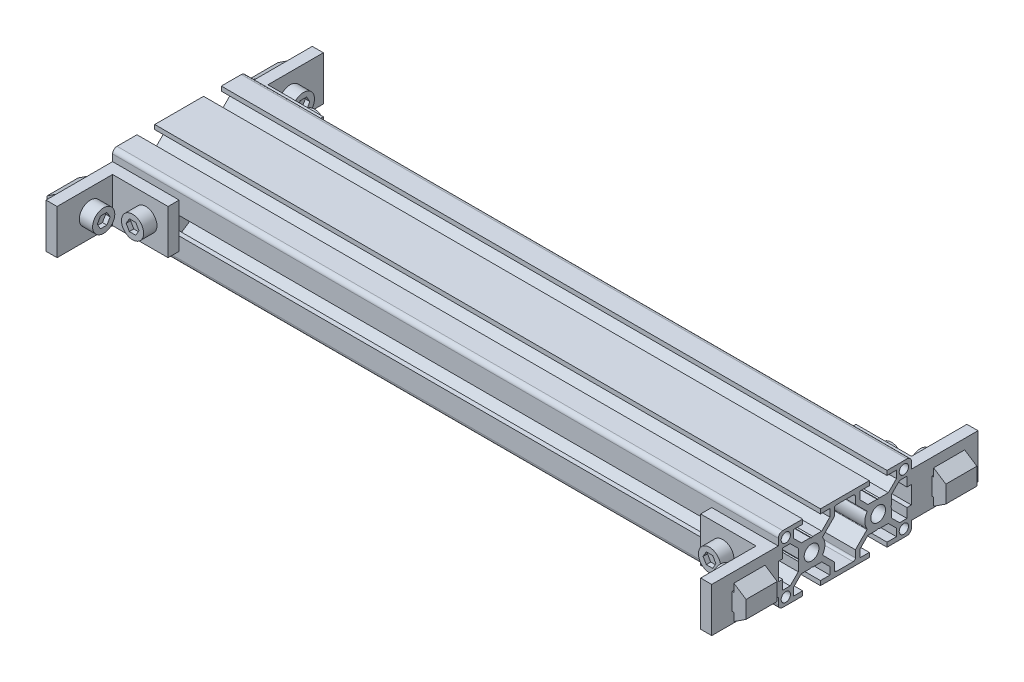
from build123d import *

# Parameters (mm, degrees)
SKETCH1_R            = 2.1
SKETCH1_R_2          = 3.3235
BOSS_EXTRUDE1_DEPTH  = 300
BOSS_EXTRUDE2_DEPTH  = 10
CUT_EXTRUDE1_DEPTH   = 2
BOSS_EXTRUDE3_DEPTH  = 7
CUT_EXTRUDE2_DEPTH   = 2
BOSS_EXTRUDE4_DEPTH  = 7
MIRROR2_COPY_1_DEPTH = 10
MIRROR2_COPY_3_DEPTH = 2
MIRROR2_COPY_4_DEPTH = 7
MIRROR2_COPY_6_DEPTH = 2
MIRROR2_COPY_7_DEPTH = 7


with BuildPart() as part:
    # Sketch1 → Boss-Extrude1 (new body)
    with BuildSketch(Plane(origin=(0, 0, 0), x_dir=(0, 0, -1), z_dir=(1, 0, 0))):
        with BuildLine():
            Line((-11, -15), (11, -15))
            Line((11, -15), (11, -13))
            Line((11, -13), (6.75, -13))
            Line((6.75, -13), (6.75, -9.664213562))
            Line((6.75, -9.664213562), (10.414213562, -6))
            Line((10.414213562, -6), (14.480384758, -6))
            Line((14.480384758, -6), (15, -5.7))
            Line((15, -5.7), (15.519615242, -6))
            Line((15.519615242, -6), (19.585786438, -6))
            Line((19.585786438, -6), (23.25, -9.664213562))
            Line((23.25, -9.664213562), (23.25, -13))
            Line((23.25, -13), (19, -13))
            Line((19, -13), (19, -15))
            Line((19, -15), (28, -15))
            ThreePointArc((28, -15), (29.414213562, -14.414213562), (30, -13))
            Line((30, -13), (30, -4))
            Line((30, -4), (28, -4))
            Line((28, -4), (28, -8.25))
            Line((28, -8.25), (24.664213562, -8.25))
            Line((24.664213562, -8.25), (21, -4.585786438))
            Line((21, -4.585786438), (21, -0.519615242))
            Line((21, -0.519615242), (20.7, 0))
            Line((20.7, 0), (21, 0.519615242))
            Line((21, 0.519615242), (21, 4.585786438))
            Line((21, 4.585786438), (24.664213562, 8.25))
            Line((24.664213562, 8.25), (28, 8.25))
            Line((28, 8.25), (28, 4))
            Line((28, 4), (30, 4))
            Line((30, 4), (30, 13))
            ThreePointArc((30, 13), (29.414213562, 14.414213562), (28, 15))
            Line((28, 15), (19, 15))
            Line((19, 15), (19, 13))
            Line((19, 13), (23.25, 13))
            Line((23.25, 13), (23.25, 9.664213562))
            Line((23.25, 9.664213562), (19.585786438, 6))
            Line((19.585786438, 6), (15.519615242, 6))
            Line((15.519615242, 6), (15, 5.7))
            Line((15, 5.7), (14.480384758, 6))
            Line((14.480384758, 6), (10.414213562, 6))
            Line((10.414213562, 6), (6.75, 9.664213562))
            Line((6.75, 9.664213562), (6.75, 13))
            Line((6.75, 13), (11, 13))
            Line((11, 13), (11, 15))
            Line((11, 15), (-11, 15))
            Line((-11, 15), (-11, 13))
            Line((-11, 13), (-6.75, 13))
            Line((-6.75, 13), (-6.75, 9.664213562))
            Line((-6.75, 9.664213562), (-10.414213562, 6))
            Line((-10.414213562, 6), (-14.480384758, 6))
            Line((-14.480384758, 6), (-15, 5.7))
            Line((-15, 5.7), (-15.519615242, 6))
            Line((-15.519615242, 6), (-19.585786438, 6))
            Line((-19.585786438, 6), (-23.25, 9.664213562))
            Line((-23.25, 9.664213562), (-23.25, 13))
            Line((-23.25, 13), (-19, 13))
            Line((-19, 13), (-19, 15))
            Line((-19, 15), (-28, 15))
            ThreePointArc((-28, 15), (-29.414213562, 14.414213562), (-30, 13))
            Line((-30, 13), (-30, 4))
            Line((-30, 4), (-28, 4))
            Line((-28, 4), (-28, 8.25))
            Line((-28, 8.25), (-24.664213562, 8.25))
            Line((-24.664213562, 8.25), (-21, 4.585786438))
            Line((-21, 4.585786438), (-21, 0.519615242))
            Line((-21, 0.519615242), (-20.7, 0))
            Line((-20.7, 0), (-21, -0.519615242))
            Line((-21, -0.519615242), (-21, -4.585786438))
            Line((-21, -4.585786438), (-24.664213562, -8.25))
            Line((-24.664213562, -8.25), (-28, -8.25))
            Line((-28, -8.25), (-28, -4))
            Line((-28, -4), (-30, -4))
            Line((-30, -4), (-30, -13))
            ThreePointArc((-30, -13), (-29.414213562, -14.414213562), (-28, -15))
            Line((-28, -15), (-19, -15))
            Line((-19, -15), (-19, -13))
            Line((-19, -13), (-23.25, -13))
            Line((-23.25, -13), (-23.25, -9.664213562))
            Line((-23.25, -9.664213562), (-19.585786438, -6))
            Line((-19.585786438, -6), (-15.519615242, -6))
            Line((-15.519615242, -6), (-15, -5.7))
            Line((-15, -5.7), (-14.480384758, -6))
            Line((-14.480384758, -6), (-10.414213562, -6))
            Line((-10.414213562, -6), (-6.75, -9.664213562))
            Line((-6.75, -9.664213562), (-6.75, -13))
            Line((-6.75, -13), (-11, -13))
            Line((-11, -13), (-11, -15))
        make_face()
        with Locations((-26.6, -11.6)):
            Circle(SKETCH1_R, mode=Mode.SUBTRACT)
        with Locations((-26.6, 11.6)):
            Circle(SKETCH1_R, mode=Mode.SUBTRACT)
        with Locations((-15, 0)):
            Circle(SKETCH1_R_2, mode=Mode.SUBTRACT)
        with Locations((26.6, -11.6)):
            Circle(SKETCH1_R, mode=Mode.SUBTRACT)
        with Locations((15, 0)):
            Circle(SKETCH1_R_2, mode=Mode.SUBTRACT)
        with Locations((26.6, 11.6)):
            Circle(SKETCH1_R, mode=Mode.SUBTRACT)
        with BuildLine():
            Line((4.75, 8.835786438), (4.75, 12))
            ThreePointArc((4.75, 12), (4.457106781, 12.707106781), (3.75, 13))
            Line((3.75, 13), (-3.75, 13))
            ThreePointArc((-3.75, 13), (-4.457106781, 12.707106781), (-4.75, 12))
            Line((-4.75, 12), (-4.75, 8.835786438))
            Line((-4.75, 8.835786438), (-9.933994275, 3.651792162))
            ThreePointArc((-9.933994275, 3.651792162), (-10.020243756, 3.470780401), (-9.973202134, 3.275866789))
            ThreePointArc((-9.973202134, 3.275866789), (-9, 0), (-9.973202134, -3.275866789))
            ThreePointArc((-9.973202134, -3.275866789), (-10.020243756, -3.470780401), (-9.933994275, -3.651792162))
            Line((-9.933994275, -3.651792162), (-4.75, -8.835786438))
            Line((-4.75, -8.835786438), (-4.75, -12))
            ThreePointArc((-4.75, -12), (-4.457106781, -12.707106781), (-3.75, -13))
            Line((-3.75, -13), (3.75, -13))
            ThreePointArc((3.75, -13), (4.457106781, -12.707106781), (4.75, -12))
            Line((4.75, -12), (4.75, -8.835786438))
            Line((4.75, -8.835786438), (9.933994275, -3.651792162))
            ThreePointArc((9.933994275, -3.651792162), (10.020243756, -3.470780401), (9.973202134, -3.275866789))
            ThreePointArc((9.973202134, -3.275866789), (9, 0), (9.973202134, 3.275866789))
            ThreePointArc((9.973202134, 3.275866789), (10.020243756, 3.470780401), (9.933994275, 3.651792162))
            Line((9.933994275, 3.651792162), (4.75, 8.835786438))
        make_face(mode=Mode.SUBTRACT)
    extrude(amount=BOSS_EXTRUDE1_DEPTH)

    # Sketch2 → Boss-Extrude2 (add, symmetric)
    with BuildSketch(Plane(origin=(0, 0, 0), x_dir=(1, 0, 0), z_dir=(0, 1, 0))):
        Polygon((0, 60), (0, 30), (30, 30), (30, 35), (5, 35), (5, 60), align=None)
    boss_extrude2 = extrude(amount=BOSS_EXTRUDE2_DEPTH, both=True)

    # Sketch3 → Revolve1 (revolve)
    with BuildSketch(Plane(origin=(20, 0, 0), x_dir=(0, 0, -1), z_dir=(1, 0, 0)), mode=Mode.PRIVATE) as revolve1_sk:
        Polygon((23, 0), (23, 3), (35, 3), (35, 5), (41, 5), (41, 0), align=None)
    revolve1 = revolve(revolve1_sk.sketch.rotate(Axis((20, 0, 0), (0, 0, -1)), 180), axis=Axis((20, 0, 0), (0, 0, -1)))

    # Sketch4 → Cut-Extrude1 (cut)
    with BuildSketch(Plane(origin=(0, 0, -41), x_dir=(-1, 0, 0), z_dir=(0, 0, -1))):
        Polygon((-17.113248654, 0), (-18.556624327, 2.5), (-21.443375673, 2.5), (-22.886751346, 0), (-21.443375673, -2.5), (-18.556624327, -2.5), align=None)
    cut_extrude1 = extrude(amount=-CUT_EXTRUDE1_DEPTH, mode=Mode.SUBTRACT)

    # Sketch5 → Boss-Extrude3 (add, symmetric)
    with BuildSketch(Plane(origin=(20, 0, 0), x_dir=(0, 0, -1), z_dir=(1, 0, 0))):
        Polygon((28, 7.5), (28, 3.9), (28.8, 3.9), (28.8, -3.9), (28, -3.9), (28, -7.5), (22.5, -3.9), (22.5, 3.9), align=None)
    boss_extrude3 = extrude(amount=BOSS_EXTRUDE3_DEPTH, both=True)

    # Sketch6 → Revolve2 (revolve)
    with BuildSketch(Plane(origin=(0, 0, -45), x_dir=(-1, 0, 0), z_dir=(0, 0, -1)), mode=Mode.PRIVATE) as revolve2_sk:
        Polygon((-11, 0), (-11, 5), (-5, 5), (-5, 3), (7, 3), (7, 0), align=None)
    revolve2 = revolve(revolve2_sk.sketch.rotate(Axis((-7, 0, -45), (1, 0, 0)), 90), axis=Axis((-7, 0, -45), (1, 0, 0)))

    # Sketch7 → Cut-Extrude2 (cut)
    with BuildSketch(Plane(origin=(11, 0, 0), x_dir=(0, 0, -1), z_dir=(1, 0, 0))):
        Polygon((47.886751346, 0), (46.443375673, 2.5), (43.556624327, 2.5), (42.113248654, 0), (43.556624327, -2.5), (46.443375673, -2.5), align=None)
    cut_extrude2 = extrude(amount=-CUT_EXTRUDE2_DEPTH, mode=Mode.SUBTRACT)

    # Sketch8 → Boss-Extrude4 (add, symmetric)
    with BuildSketch(Plane(origin=(0, 0, -45), x_dir=(-1, 0, 0), z_dir=(0, 0, -1))):
        Polygon((1.2, -3.9), (1.2, 3.9), (2, 3.9), (2, 7.5), (7.5, 3.9), (7.5, -3.9), (2, -7.5), (2, -3.9), align=None)
    boss_extrude4 = extrude(amount=BOSS_EXTRUDE4_DEPTH, both=True)

    # Mirror1: Boss-Extrude2, Revolve1, Cut-Extrude1, Boss-Extrude3, Revolve2, Cut-Extrude2, Boss-Extrude4 across plane
    add(boss_extrude2.mirror(Plane.XY))
    add(revolve1.mirror(Plane.XY))
    add(cut_extrude1.mirror(Plane.XY), mode=Mode.SUBTRACT)
    add(boss_extrude3.mirror(Plane.XY))
    add(revolve2.mirror(Plane.XY))
    add(cut_extrude2.mirror(Plane.XY), mode=Mode.SUBTRACT)
    add(boss_extrude4.mirror(Plane.XY))

    # Mirror2: Boss-Extrude2, Revolve1, Cut-Extrude1, Boss-Extrude3, Revolve2, Cut-Extrude2, Boss-Extrude4 across plane
    add(boss_extrude2.mirror(Plane(origin=(150, 0, 0), x_dir=(0, 0, 1), z_dir=(1, 0, 0))))
    add(revolve1.mirror(Plane(origin=(150, 0, 0), x_dir=(0, 0, 1), z_dir=(1, 0, 0))))
    add(cut_extrude1.mirror(Plane(origin=(150, 0, 0), x_dir=(0, 0, 1), z_dir=(1, 0, 0))), mode=Mode.SUBTRACT)
    add(boss_extrude3.mirror(Plane(origin=(150, 0, 0), x_dir=(0, 0, 1), z_dir=(1, 0, 0))))
    add(revolve2.mirror(Plane(origin=(150, 0, 0), x_dir=(0, 0, 1), z_dir=(1, 0, 0))))
    add(cut_extrude2.mirror(Plane(origin=(150, 0, 0), x_dir=(0, 0, 1), z_dir=(1, 0, 0))), mode=Mode.SUBTRACT)
    add(boss_extrude4.mirror(Plane(origin=(150, 0, 0), x_dir=(0, 0, 1), z_dir=(1, 0, 0))))

    # Mirror2 copy 1 sketch → Mirror2 copy 1 (add, symmetric)
    with BuildSketch(Plane(origin=(300, 0, 0), x_dir=(-1, 0, 0), z_dir=(0, 1, 0))):
        Polygon((0, 60), (0, 30), (30, 30), (30, 35), (5, 35), (5, 60), align=None)
    extrude(amount=MIRROR2_COPY_1_DEPTH, both=True)

    # Mirror2 copy 2 sketch → Mirror2 copy 2 (revolve)
    with BuildSketch(Plane.ZY.offset(-280)):
        Polygon((23, 0), (23, 3), (35, 3), (35, 5), (41, 5), (41, 0), align=None)
    revolve(axis=Axis((280, 0, 0), (0, 0, 1)))

    # Mirror2 copy 3 sketch → Mirror2 copy 3 (cut)
    with BuildSketch(Plane(origin=(300, 0, 41), x_dir=(1, 0, 0), z_dir=(0, 0, 1))):
        Polygon((-17.113248654, 0), (-18.556624327, 2.5), (-21.443375673, 2.5), (-22.886751346, 0), (-21.443375673, -2.5), (-18.556624327, -2.5), align=None)
    extrude(amount=-MIRROR2_COPY_3_DEPTH, mode=Mode.SUBTRACT)

    # Mirror2 copy 4 sketch → Mirror2 copy 4 (add, symmetric)
    with BuildSketch(Plane.ZY.offset(-280)):
        Polygon((28, 7.5), (28, 3.9), (28.8, 3.9), (28.8, -3.9), (28, -3.9), (28, -7.5), (22.5, -3.9), (22.5, 3.9), align=None)
    extrude(amount=MIRROR2_COPY_4_DEPTH, both=True)

    # Mirror2 copy 5 sketch → Mirror2 copy 5 (revolve)
    with BuildSketch(Plane(origin=(300, 0, 45), x_dir=(1, 0, 0), z_dir=(0, 0, 1))):
        Polygon((-11, 0), (-11, 5), (-5, 5), (-5, 3), (7, 3), (7, 0), align=None)
    revolve(axis=Axis((307, 0, 45), (-1, 0, 0)))

    # Mirror2 copy 6 sketch → Mirror2 copy 6 (cut)
    with BuildSketch(Plane.ZY.offset(-289)):
        Polygon((47.886751346, 0), (46.443375673, 2.5), (43.556624327, 2.5), (42.113248654, 0), (43.556624327, -2.5), (46.443375673, -2.5), align=None)
    extrude(amount=-MIRROR2_COPY_6_DEPTH, mode=Mode.SUBTRACT)

    # Mirror2 copy 7 sketch → Mirror2 copy 7 (add, symmetric)
    with BuildSketch(Plane(origin=(300, 0, 45), x_dir=(1, 0, 0), z_dir=(0, 0, 1))):
        Polygon((1.2, -3.9), (1.2, 3.9), (2, 3.9), (2, 7.5), (7.5, 3.9), (7.5, -3.9), (2, -7.5), (2, -3.9), align=None)
    extrude(amount=MIRROR2_COPY_7_DEPTH, both=True)


solid = part.part
